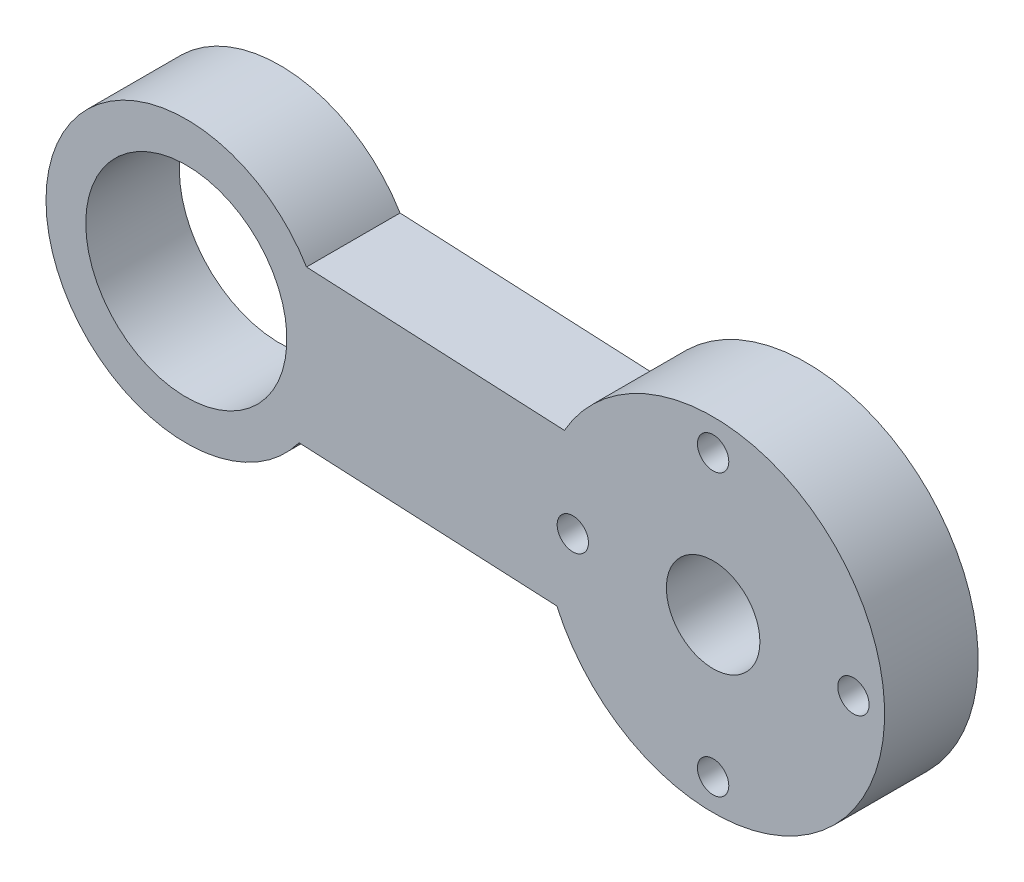
from build123d import *

# Parameters (mm, degrees)
BOSS_EXTRU_1_DEPTH      = 6
ESQUISSE2_R             = 1.005
ESQUISSE2_R_2           = 3
ENL_V_MAT_EXTRU_1_DEPTH = 6
ESQUISSE3_R             = 9
BOSS_EXTRU_2_DEPTH      = 6
ESQUISSE5_R             = 6.45
ENL_V_MAT_EXTRU_2_DEPTH = 6


with BuildPart() as part:
    # Esquisse1 → Boss.-Extru.1 (new body)
    with BuildSketch(Plane.XY):
        with BuildLine():
            Line((-10.02588737, -4.525658234), (-40.02588737, -3.070914704))
            Line((-40.02588737, -3.070914704), (-39.541047229, 6.929085296))
            Line((-39.541047229, 6.929085296), (-9.541047229, 5.474341766))
            ThreePointArc((-9.541047229, 5.474341766), (10.987093901, -0.532698415), (-10.02588737, -4.525658234))
        make_face()
    extrude(amount=BOSS_EXTRU_1_DEPTH)

    # Esquisse2 → Enlèv. mat.-Extru.1 (cut)
    with BuildSketch(Plane.XY.offset(6)):
        with Locations((0, 9)):
            Circle(ESQUISSE2_R)
        with Locations((9, 0)):
            Circle(ESQUISSE2_R)
        with Locations((0, -9)):
            Circle(ESQUISSE2_R)
        with Locations((-9, 0)):
            Circle(ESQUISSE2_R)
        with Locations((-33.790793572, 1.632611651)):
            Circle(ESQUISSE2_R)
        Circle(ESQUISSE2_R_2)
    extrude(amount=-ENL_V_MAT_EXTRU_1_DEPTH, mode=Mode.SUBTRACT)

    # Esquisse3 → Boss.-Extru.2 (add)
    with BuildSketch(Plane(origin=(0, 0, 0), x_dir=(-1, 0, 0), z_dir=(0, 0, -1))):
        with Locations((33.790793572, 1.632611651)):
            Circle(ESQUISSE3_R)
    extrude(amount=-BOSS_EXTRU_2_DEPTH)

    # Esquisse5 → Enlèv. mat.-Extru.2 (cut)
    with BuildSketch(Plane(origin=(0, 0, 0), x_dir=(-1, 0, 0), z_dir=(0, 0, -1))):
        with Locations((33.790793572, 1.632611651)):
            Circle(ESQUISSE5_R)
    extrude(amount=-ENL_V_MAT_EXTRU_2_DEPTH, mode=Mode.SUBTRACT)


solid = part.part
